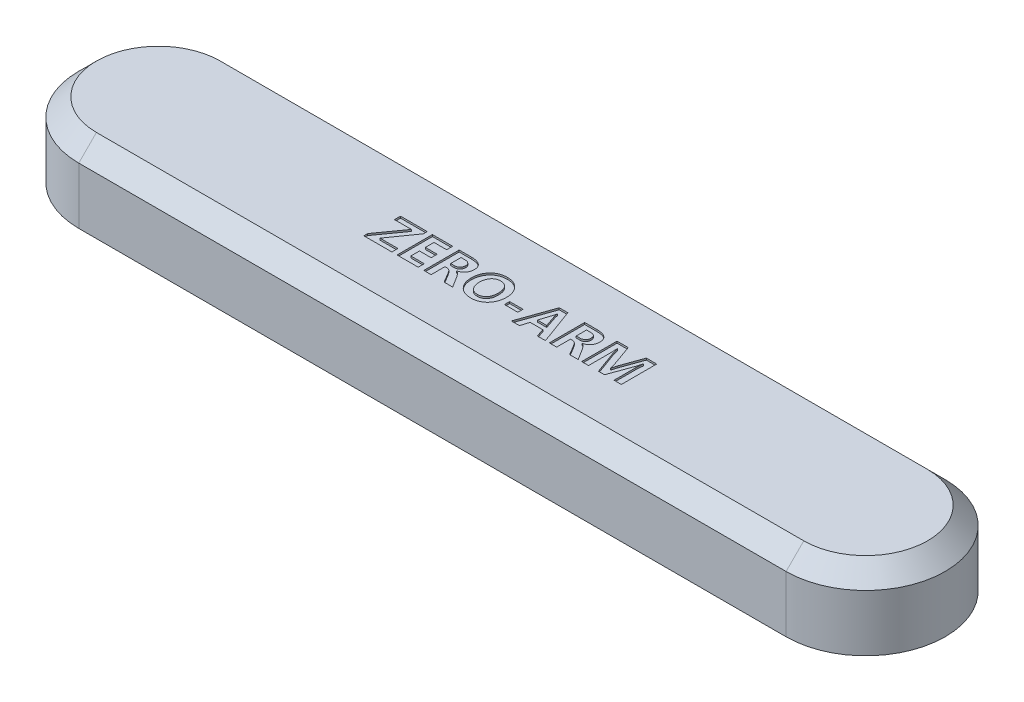
from build123d import *

# Parameters (mm, degrees)
EXTRUDE_1_DEPTH     = 21
CHAMFER_1_SIZE      = 5
SHELL_1_T           = -2.5
CUT_EXTRUDE_2_DEPTH = 1.2
SKETCH_4_R          = 5
EXTRUDE_3_DEPTH     = 17.5
SKETCH_5_R          = 1.6
CUT_EXTRUDE_3_DEPTH = 10
CUT_EXTRUDE_4_DEPTH = 2.4
SKETCH_7_W          = 3.780487805
SKETCH_7_H          = 1.463414634
CUT_EXTRUDE_5_DEPTH = 0.5


with BuildPart() as part:
    # 草图1 → 凸台-拉伸1 (new body)
    with BuildSketch(Plane(origin=(0, 0, 0), x_dir=(1, 0, 0), z_dir=(0, 1, 0))):
        with BuildLine():
            ThreePointArc((-77.5, 0), (-84.090097423, 15.909902577), (-100, 22.5))
            Line((-100, 22.5), (-100, -22.5))
            ThreePointArc((-100, -22.5), (-84.090097423, -15.909902577), (-77.5, 0))
        make_face()
        with BuildLine():
            Line((-100, -22.5), (-100, 22.5))
            ThreePointArc((-100, 22.5), (-122.5, 0), (-100, -22.5))
        make_face()
        with BuildLine():
            Line((100, 22.5), (-100, 22.5))
            ThreePointArc((-100, 22.5), (-84.090097423, 15.909902577), (-77.5, 0))
            ThreePointArc((-77.5, 0), (-84.090097423, -15.909902577), (-100, -22.5))
            Line((-100, -22.5), (100, -22.5))
            ThreePointArc((100, -22.5), (77.5, 0), (100, 22.5))
        make_face()
        with BuildLine():
            ThreePointArc((122.5, 0), (115.909902577, 15.909902577), (100, 22.5))
            Line((100, 22.5), (100, -22.5))
            ThreePointArc((100, -22.5), (115.909902577, -15.909902577), (122.5, 0))
        make_face()
        with BuildLine():
            Line((100, -22.5), (100, 22.5))
            ThreePointArc((100, 22.5), (77.5, 0), (100, -22.5))
        make_face()
    extrude(amount=EXTRUDE_1_DEPTH)

    # 倒角1
    chamfer_1_edges = [part.edges().sort_by_distance(p)[0] for p in [
        (0, 21, 22.5),
        (122.5, 21, 0),
        (0, 21, -22.5),
        (-122.5, 21, 0),
    ]]
    chamfer(chamfer_1_edges, length=CHAMFER_1_SIZE)

    # 抽壳1
    shell_1_openings = [part.faces().sort_by_distance(p)[0] for p in [
        (0, 0, 0),
    ]]
    offset(amount=SHELL_1_T, openings=shell_1_openings, kind=Kind.INTERSECTION)

    # 草图2 → 切除-拉伸2 (cut)
    with BuildSketch(Plane.XZ):
        with BuildLine():
            Line((-100, -21.2), (100, -21.2))
            ThreePointArc((100, -21.2), (121.2, 0), (100, 21.2))
            Line((100, 21.2), (-100, 21.2))
            ThreePointArc((-100, 21.2), (-121.2, 0), (-100, -21.2))
        make_face()
        with BuildLine():
            Line((-100, -20), (100, -20))
            ThreePointArc((100, -20), (120, 0), (100, 20))
            Line((100, 20), (-100, 20))
            ThreePointArc((-100, 20), (-120, 0), (-100, -20))
        make_face(mode=Mode.SUBTRACT)
    extrude(amount=-CUT_EXTRUDE_2_DEPTH, mode=Mode.SUBTRACT)

    # 草图4 → 凸台-拉伸3 (add)
    with BuildSketch(Plane.XZ.offset(-18.5)):
        with Locations(Location((-15, 0, 0), (0, 0, 90))):
            Circle(SKETCH_4_R)
    extrude_3 = extrude(amount=EXTRUDE_3_DEPTH)

    # 草图5 → 切除-拉伸3 (cut)
    with BuildSketch(Plane.XZ.offset(-1)):
        with Locations(Location((-15, 0, 0), (0, 0, 270))):
            Circle(SKETCH_5_R)
    cut_extrude_3 = extrude(amount=-CUT_EXTRUDE_3_DEPTH, mode=Mode.SUBTRACT)

    # 草图6 → 切除-拉伸4 (cut)
    with BuildSketch(Plane.XZ.offset(-1)):
        Polygon((-13.41228676, -2.75), (-11.824573519, 0), (-13.41228676, 2.75), (-16.58771324, 2.75), (-18.175426481, 0), (-16.58771324, -2.75), align=None)
    cut_extrude_4 = extrude(amount=-CUT_EXTRUDE_4_DEPTH, mode=Mode.SUBTRACT)

    # 镜向1: 凸台-拉伸3, 切除-拉伸3, 切除-拉伸4 across plane
    add(extrude_3.mirror(Plane(origin=(0, 0, 0), x_dir=(0, 0, 1), z_dir=(1, 0, 0))))
    add(cut_extrude_3.mirror(Plane(origin=(0, 0, 0), x_dir=(0, 0, 1), z_dir=(1, 0, 0))), mode=Mode.SUBTRACT)
    add(cut_extrude_4.mirror(Plane(origin=(0, 0, 0), x_dir=(0, 0, 1), z_dir=(1, 0, 0))), mode=Mode.SUBTRACT)

    # 草图7 → 切除-拉伸5 (cut)
    # profile 1 of 8: a face of its own
    with BuildSketch(Plane(origin=(0, 21, 0), x_dir=(1, 0, 0), z_dir=(0, 1, 0))):
        with BuildLine():
            Line((33.841463415, -5), (33.841463415, 1.061356707))
            add(Edge.make_bspline(
                [(33.841463415, 1.061356707), (33.84152232, 1.133778964), (33.841643281, 1.282498386), (33.853112321, 1.512383794), (33.86552206, 1.75574995), (33.884814363, 2.01303563), (33.910440556, 2.283491234), (33.937690867, 2.567715397), (33.975295445, 2.864692245), (34.001478381, 3.067207947), (34.014862805, 3.170731707)],
                knots=[0, 0, 0, 0, 0.820532149, 1.684966374, 2.607606779, 3.581914253, 4.608215301, 5.686044516, 6.81713186, 8, 8, 8, 8], degree=3))
            Line((34.014862805, 3.170731707), (33.963414634, 3.170731707))
            add(Edge.make_bspline(
                [(33.963414634, 3.170731707), (33.947784071, 3.093824023), (33.917910453, 2.946835674), (33.871179731, 2.736946179), (33.830302888, 2.546651387), (33.789921776, 2.376494295), (33.75227913, 2.225805247), (33.715712976, 2.095229622), (33.684547566, 1.984086667), (33.661368239, 1.918098365), (33.650914634, 1.888338415)],
                knots=[0, 0, 0, 0, 1.426064356, 2.725538406, 3.907327566, 4.962762773, 5.903337351, 6.72936823, 7.426959974, 8, 8, 8, 8], degree=3))
            Line((33.650914634, 1.888338415), (31.158536585, -5))
            Line((31.158536585, -5), (29.451219512, -5))
            Line((29.451219512, -5), (26.960746951, 1.823551829))
            add(Edge.make_bspline(
                [(26.960746951, 1.823551829), (26.952263157, 1.848251918), (26.932412136, 1.906047048), (26.904694926, 2.007385078), (26.872657868, 2.135937022), (26.834101068, 2.290532503), (26.794925524, 2.4733177), (26.7495779, 2.681727965), (26.696668035, 2.916796986), (26.663729611, 3.082995658), (26.646341463, 3.170731707)],
                knots=[0, 0, 0, 0, 0.452786508, 1.059464042, 1.820794487, 2.75042866, 3.822030313, 5.062086147, 6.449079346, 8, 8, 8, 8], degree=3))
            Line((26.646341463, 3.170731707), (26.589176829, 3.170731707))
            add(Edge.make_bspline(
                [(26.589176829, 3.170731707), (26.606326066, 2.75094685), (26.640641054, 1.910972851), (26.644440717, 1.070306717), (26.646341463, 0.649771341)],
                knots=[0, 0, 0, 0, 0.999518694, 2, 2, 2, 2], degree=3))
            Line((26.646341463, 0.649771341), (26.646341463, -5))
            Line((26.646341463, -5), (24.695121951, -5))
            Line((24.695121951, -5), (24.695121951, 5))
            Line((24.695121951, 5), (27.865853659, 5))
            Line((27.865853659, 5), (30.001905488, -1.044207317))
            add(Edge.make_bspline(
                [(30.001905488, -1.044207317), (30.044244035, -1.167087774), (30.126860295, -1.406867466), (30.230472788, -1.764546405), (30.311442003, -2.111250573), (30.349265281, -2.340345695), (30.367759146, -2.452362805)],
                knots=[0, 0, 0, 0, 1.070175583, 2.088260221, 3.065246074, 4, 4, 4, 4], degree=3))
            Line((30.367759146, -2.452362805), (30.411585366, -2.452362805))
            add(Edge.make_bspline(
                [(30.411585366, -2.452362805), (30.444575956, -2.320069904), (30.508517424, -2.063663387), (30.612188826, -1.694948076), (30.713260036, -1.352114621), (30.78868984, -1.135406264), (30.82507622, -1.030868902)],
                knots=[0, 0, 0, 0, 1.1046679, 2.14103741, 3.103260037, 4, 4, 4, 4], degree=3))
            Line((30.82507622, -1.030868902), (32.987804878, 5))
            Line((32.987804878, 5), (35.914634146, 5))
            Line((35.914634146, 5), (35.914634146, -5))
            Line((35.914634146, -5), (33.841463415, -5))
        make_face()
    # profile 2 of 8: a face of its own
    with BuildSketch(Plane(origin=(0, 21, 0), x_dir=(1, 0, 0), z_dir=(0, 1, 0))):
        with BuildLine():
            Line((23.719512195, -5), (21.290015244, -5))
            Line((21.290015244, -5), (19.737042683, -2.37804878))
            add(Edge.make_bspline(
                [(19.737042683, -2.37804878), (19.697214303, -2.313147359), (19.621077115, -2.189079751), (19.508541387, -2.012316653), (19.400469484, -1.854728719), (19.297321705, -1.715033671), (19.200128655, -1.592972956), (19.109608107, -1.487067553), (19.022311196, -1.401644555), (18.916023531, -1.312725889), (18.783758664, -1.22603169), (18.618101361, -1.153239455), (18.447648594, -1.106566857), (18.331718612, -1.100567269), (18.273628049, -1.097560976)],
                knots=[0, 0, 0, 0, 1.344687602, 2.570547293, 3.699885006, 4.718342757, 5.636226837, 6.4550131, 7.176785554, 7.789997554, 8.90063289, 9.955199024, 10.975384649, 12, 12, 12, 12], degree=3))
            Line((18.273628049, -1.097560976), (17.62195122, -1.097560976))
            Line((17.62195122, -1.097560976), (17.62195122, -5))
            Line((17.62195122, -5), (15.548780488, -5))
            Line((15.548780488, -5), (15.548780488, 5))
            Line((15.548780488, 5), (18.991996951, 5))
            add(Edge.make_bspline(
                [(18.991996951, 5), (19.133688638, 4.997599585), (19.40788366, 4.992954417), (19.806379939, 4.963111029), (20.17696591, 4.910572781), (20.520923961, 4.83614774), (20.837492196, 4.741954091), (21.127023154, 4.626152811), (21.388633842, 4.487756679), (21.624246274, 4.330121526), (21.83286269, 4.149961897), (22.010305726, 3.945932323), (22.163218948, 3.722739544), (22.286853211, 3.477838821), (22.382789619, 3.21152998), (22.450219302, 2.92446668), (22.493483114, 2.616276079), (22.497786357, 2.403607024), (22.5, 2.294207317)],
                knots=[0, 0, 0, 0, 1.344792196, 2.602377979, 3.789948482, 4.894324818, 5.93942703, 6.921166634, 7.848816369, 8.743320004, 9.60643787, 10.456510383, 11.302554906, 12.16796436, 13.052787244, 13.982706318, 14.96227809, 16, 16, 16, 16], degree=3))
            add(Edge.make_bspline(
                [(22.5, 2.294207317), (22.49805954, 2.210933862), (22.494242565, 2.047131067), (22.467331146, 1.805502409), (22.421503833, 1.573015739), (22.358541107, 1.349308277), (22.278738388, 1.134588575), (22.17864023, 0.92946216), (22.060357292, 0.733301397), (21.925032795, 0.546680252), (21.77449854, 0.371553855), (21.609988236, 0.208416662), (21.4310822, 0.06034869), (21.238253937, -0.074065872), (21.033562131, -0.195929417), (20.813714798, -0.302520323), (20.582174684, -0.399146389), (20.41967857, -0.449122103), (20.337271341, -0.474466463)],
                knots=[0, 0, 0, 0, 1.054005705, 2.073278704, 3.072957091, 4.050336958, 5.012048933, 5.968537561, 6.935110338, 7.908082122, 8.883044982, 9.855219194, 10.837283597, 11.818689559, 12.82802068, 13.849194482, 14.909254402, 16, 16, 16, 16], degree=3))
            Line((20.337271341, -0.474466463), (20.337271341, -0.501143293))
            add(Edge.make_bspline(
                [(20.337271341, -0.501143293), (20.395941004, -0.524149982), (20.519249457, -0.572504091), (20.696144138, -0.686032125), (20.879397295, -0.827181335), (21.066548715, -1.002920247), (21.258143735, -1.211001616), (21.454695814, -1.452191381), (21.654151855, -1.727370472), (21.784314876, -1.92464988), (21.852134146, -2.027439024)],
                knots=[0, 0, 0, 0, 0.69086025, 1.452009525, 2.2978205, 3.231026083, 4.267962337, 5.403581846, 6.647179632, 8, 8, 8, 8], degree=3))
            Line((21.852134146, -2.027439024), (23.719512195, -5))
        make_face()
        with BuildLine():
            Line((17.658155488, 3.414634146), (17.658155488, 0.487804878))
            Line((17.658155488, 0.487804878), (18.681402439, 0.487804878))
            add(Edge.make_bspline(
                [(18.681402439, 0.487804878), (18.741169585, 0.48934115), (18.857903796, 0.492341719), (19.028171092, 0.513613079), (19.189434334, 0.548101429), (19.342605393, 0.594909769), (19.485929259, 0.658549446), (19.620239969, 0.734865042), (19.744909713, 0.825600012), (19.860786305, 0.927935487), (19.965413267, 1.041294511), (20.054390295, 1.164799839), (20.134199188, 1.292136901), (20.196807416, 1.428044482), (20.244750808, 1.570636579), (20.27885505, 1.720002496), (20.300225552, 1.876294199), (20.303312748, 1.982909397), (20.304878049, 2.036966463)],
                knots=[0, 0, 0, 0, 1.139255335, 2.225136757, 3.26536478, 4.280265435, 5.272446734, 6.248687742, 7.219959804, 8.206435245, 9.192018485, 10.153504372, 11.104641096, 12.052689706, 12.998493128, 13.967800733, 14.969614728, 16, 16, 16, 16], degree=3))
            add(Edge.make_bspline(
                [(20.304878049, 2.036966463), (20.304107427, 2.092937844), (20.302622514, 2.200789328), (20.281948658, 2.357376447), (20.253495637, 2.503463651), (20.208295437, 2.638373039), (20.153408189, 2.763547164), (20.085137541, 2.877678603), (20.003607829, 2.980690096), (19.90934136, 3.071787431), (19.804785994, 3.155372091), (19.684702435, 3.222894898), (19.554189564, 3.282651939), (19.41129702, 3.331895281), (19.255684708, 3.370007901), (19.088023489, 3.396144998), (18.907794195, 3.411132554), (18.783692405, 3.413440549), (18.719512195, 3.414634146)],
                knots=[0, 0, 0, 0, 1.115541977, 2.149542461, 3.145912998, 4.079405741, 4.981150481, 5.867636171, 6.724381264, 7.5934034, 8.477895152, 9.386201992, 10.333011507, 11.338682132, 12.395710985, 13.52462607, 14.719841052, 16, 16, 16, 16], degree=3))
            Line((18.719512195, 3.414634146), (17.658155488, 3.414634146))
        make_face(mode=Mode.SUBTRACT)
    # profile 3 of 8: a face of its own
    with BuildSketch(Plane(origin=(0, 21, 0), x_dir=(1, 0, 0), z_dir=(0, 1, 0))):
        Polygon((14.451219512, -5), (12.158917683, -5), (11.421493902, -2.682926829), (7.822027439, -2.682926829), (7.096036585, -5), (4.817073171, -5), (8.353658537, 5), (10.792682927, 5), align=None)
        with BuildLine():
            Line((10.918445122, -1.097560976), (9.727515244, 2.410442073))
            add(Edge.make_bspline(
                [(9.727515244, 2.410442073), (9.710332631, 2.470608831), (9.673886471, 2.598228957), (9.630143261, 2.805525593), (9.596882028, 3.039874975), (9.581339514, 3.205588019), (9.573170732, 3.292682927)],
                knots=[0, 0, 0, 0, 0.836572256, 1.774459205, 2.830307706, 4, 4, 4, 4], degree=3))
            add(Edge.make_bspline(
                [(9.573170732, 3.292682927), (9.557008697, 3.146403329), (9.524961479, 2.856349873), (9.443808347, 2.576055415), (9.403582317, 2.437118902)],
                knots=[0, 0, 0, 0, 1.008638885, 2, 2, 2, 2], degree=3))
            Line((9.403582317, 2.437118902), (8.285060976, -1.097560976))
            Line((8.285060976, -1.097560976), (10.918445122, -1.097560976))
        make_face(mode=Mode.SUBTRACT)
    # profile 4 of 8: a face of its own
    with BuildSketch(Plane(origin=(0, 21, 0), x_dir=(1, 0, 0), z_dir=(0, 1, 0))):
        with Locations((1.707317074, -1.219512195)):
            Rectangle(SKETCH_7_W, SKETCH_7_H)
    # profile 5 of 8: a face of its own
    with BuildSketch(Plane(origin=(0, 21, 0), x_dir=(1, 0, 0), z_dir=(0, 1, 0))):
        with BuildLine():
            add(Edge.make_bspline(
                [(-11.402439024, -0.127667683), (-11.39878673, 0.061814138), (-11.391631256, 0.433041649), (-11.324578967, 0.976034675), (-11.219522706, 1.493063365), (-11.068409775, 1.982386617), (-10.875664756, 2.445125951), (-10.637760929, 2.879390033), (-10.3583689, 3.288002832), (-10.036954743, 3.665187503), (-9.682183118, 4.008421608), (-9.29585205, 4.307410381), (-8.880367822, 4.558595743), (-8.438458806, 4.765245066), (-7.968794079, 4.925719877), (-7.472042096, 5.039497786), (-6.947507935, 5.109609018), (-6.588129924, 5.117775098), (-6.404344512, 5.12195122)],
                knots=[0, 0, 0, 0, 1.114768385, 2.184023191, 3.214842008, 4.216375225, 5.193220596, 6.16016609, 7.125520499, 8.10150713, 9.071799814, 10.025905719, 10.970272928, 11.923536258, 12.891752738, 13.885610077, 14.918703956, 16, 16, 16, 16], degree=3))
            add(Edge.make_bspline(
                [(-6.404344512, 5.12195122), (-6.230119813, 5.117379621), (-5.888694604, 5.108420736), (-5.389320251, 5.043499514), (-4.916337089, 4.932853645), (-4.468561878, 4.778439305), (-4.048267424, 4.576863579), (-3.652128112, 4.334078703), (-3.28482281, 4.04399496), (-2.947266171, 3.712433641), (-2.641228117, 3.348686487), (-2.375150539, 2.955510209), (-2.148799881, 2.537615937), (-1.963634771, 2.093997687), (-1.820348925, 1.624799963), (-1.720677439, 1.13081746), (-1.658038386, 0.611999646), (-1.650297442, 0.257423987), (-1.646341463, 0.076219512)],
                knots=[0, 0, 0, 0, 1.072352965, 2.101472042, 3.093497841, 4.057995957, 5.011133745, 5.957349481, 6.91241005, 7.885665393, 8.865378779, 9.833799821, 10.803025627, 11.786228153, 12.788045293, 13.817877169, 14.884834838, 16, 16, 16, 16], degree=3))
            add(Edge.make_bspline(
                [(-1.646341463, 0.076219512), (-1.64991701, -0.112639747), (-1.656909763, -0.481994809), (-1.7247599, -1.021556354), (-1.826971505, -1.534389264), (-1.97691481, -2.020005313), (-2.169216396, -2.478547788), (-2.405210295, -2.909950675), (-2.682405129, -3.313889066), (-3.000277672, -3.686351347), (-3.351763326, -4.023165742), (-3.732357243, -4.318761648), (-4.140385281, -4.567527994), (-4.5749549, -4.771030507), (-5.035558275, -4.929265444), (-5.522774181, -5.041355834), (-6.035947566, -5.109040274), (-6.386986217, -5.117585812), (-6.566310976, -5.12195122)],
                knots=[0, 0, 0, 0, 1.125525784, 2.201208718, 3.237291209, 4.239916505, 5.226012927, 6.197109501, 7.166668921, 8.141825765, 9.111444352, 10.064375446, 11.00938735, 11.954725487, 12.920015397, 13.907536101, 14.931084707, 16, 16, 16, 16], degree=3))
            add(Edge.make_bspline(
                [(-6.566310976, -5.12195122), (-6.741217462, -5.118440561), (-7.084738049, -5.111545542), (-7.586560414, -5.042156114), (-8.063840981, -4.935317338), (-8.51515245, -4.781286219), (-8.941842802, -4.585222057), (-9.34273859, -4.343017486), (-9.718130752, -4.057264383), (-10.065019677, -3.730510341), (-10.378651043, -3.369905229), (-10.65221303, -2.980546317), (-10.887206467, -2.567481768), (-11.074952418, -2.127017195), (-11.223036858, -1.662636277), (-11.326545917, -1.173049545), (-11.391067891, -0.658484724), (-11.398597842, -0.30697829), (-11.402439024, -0.127667683)],
                knots=[0, 0, 0, 0, 1.074367157, 2.110083177, 3.10723923, 4.076300727, 5.035189706, 5.987852663, 6.948956014, 7.929336404, 8.911673334, 9.88099426, 10.849387208, 11.826872217, 12.818227126, 13.84036962, 14.89832846, 16, 16, 16, 16], degree=3))
        make_face()
        with BuildLine():
            add(Edge.make_bspline(
                [(-9.207317073, -0.013338415), (-9.204972934, -0.130905921), (-9.200376886, -0.361415171), (-9.168748483, -0.699261852), (-9.111048494, -1.020100129), (-9.03266659, -1.324521887), (-8.934939316, -1.613847817), (-8.809803774, -1.884747151), (-8.664518556, -2.140297887), (-8.497666376, -2.377263176), (-8.312616041, -2.593290374), (-8.10620859, -2.779594519), (-7.884610932, -2.938469788), (-7.64665493, -3.070110786), (-7.390281654, -3.168411034), (-7.118545802, -3.241938647), (-6.829256639, -3.283269223), (-6.631222125, -3.289501009), (-6.530106707, -3.292682927)],
                knots=[0, 0, 0, 0, 1.184931797, 2.323241753, 3.415735217, 4.466896578, 5.489261642, 6.489009157, 7.469635635, 8.448254088, 9.405790831, 10.330339266, 11.243447342, 12.148780307, 13.062964896, 14.003988727, 14.980846772, 16, 16, 16, 16], degree=3))
            add(Edge.make_bspline(
                [(-6.530106707, -3.292682927), (-6.427051454, -3.290440285), (-6.225756867, -3.286059803), (-5.93279765, -3.242586114), (-5.657250021, -3.174946437), (-5.398652814, -3.078870884), (-5.158162627, -2.954740078), (-4.934545245, -2.803481778), (-4.731928343, -2.621402255), (-4.545208345, -2.416456549), (-4.379400302, -2.186434329), (-4.234862782, -1.936714362), (-4.11202961, -1.668172257), (-4.013647167, -1.380624029), (-3.935097886, -1.074925116), (-3.880740188, -0.750460673), (-3.848029015, -0.407178731), (-3.84369216, -0.172203738), (-3.841463415, -0.051448171)],
                knots=[0, 0, 0, 0, 1.038721561, 2.028902171, 2.979739093, 3.895937291, 4.804150696, 5.703190911, 6.610748933, 7.544954394, 8.494430894, 9.464599871, 10.450689967, 11.467673243, 12.525730618, 13.630462428, 14.782275302, 16, 16, 16, 16], degree=3))
            add(Edge.make_bspline(
                [(-3.841463415, -0.051448171), (-3.843681723, 0.074386246), (-3.848002774, 0.319499603), (-3.88082202, 0.676618674), (-3.933820419, 1.013469312), (-4.007225978, 1.330552564), (-4.103968605, 1.627504218), (-4.225554712, 1.902574323), (-4.363495307, 2.160149494), (-4.526387005, 2.394299833), (-4.706208205, 2.606552169), (-4.90577368, 2.790900224), (-5.122877524, 2.947408548), (-5.359382581, 3.072961483), (-5.612266109, 3.173101408), (-5.882960264, 3.242998967), (-6.171120719, 3.286049426), (-6.369253715, 3.290431706), (-6.471036585, 3.292682927)],
                knots=[0, 0, 0, 0, 1.256364881, 2.447278127, 3.577572422, 4.659071335, 5.693985313, 6.690867229, 7.65867568, 8.606938913, 9.533575709, 10.431238956, 11.313033112, 12.198355596, 13.098167223, 14.022717975, 14.984250756, 16, 16, 16, 16], degree=3))
            add(Edge.make_bspline(
                [(-6.471036585, 3.292682927), (-6.574703586, 3.289580751), (-6.776560262, 3.283540304), (-7.071367485, 3.24152036), (-7.348738522, 3.169009709), (-7.609817761, 3.067684405), (-7.853754615, 2.937344753), (-8.080128617, 2.777172381), (-8.290939017, 2.5902755), (-8.480447067, 2.373582521), (-8.651487598, 2.136232936), (-8.800639755, 1.879597159), (-8.926702559, 1.605820831), (-9.029624292, 1.31491326), (-9.109566948, 1.006946627), (-9.166114101, 0.681953199), (-9.201134008, 0.339946249), (-9.205225686, 0.106158128), (-9.207317073, -0.013338415)],
                knots=[0, 0, 0, 0, 1.030008459, 2.005595648, 2.951664227, 3.872901532, 4.782126158, 5.692664187, 6.622487942, 7.574851405, 8.547002697, 9.525586399, 10.519618393, 11.537704223, 12.587858271, 13.677387483, 14.81283889, 16, 16, 16, 16], degree=3))
        make_face(mode=Mode.SUBTRACT)
    # profile 6 of 8: a face of its own
    with BuildSketch(Plane(origin=(0, 21, 0), x_dir=(1, 0, 0), z_dir=(0, 1, 0))):
        with BuildLine():
            Line((-11.768292683, -5), (-14.197789634, -5))
            Line((-14.197789634, -5), (-15.750762195, -2.37804878))
            add(Edge.make_bspline(
                [(-15.750762195, -2.37804878), (-15.790590575, -2.313147359), (-15.866727763, -2.189079751), (-15.979263491, -2.012316653), (-16.087335394, -1.854728719), (-16.190483173, -1.715033671), (-16.287676223, -1.592972956), (-16.378196771, -1.487067553), (-16.465493682, -1.401644555), (-16.571781347, -1.312725889), (-16.704046214, -1.22603169), (-16.869703517, -1.153239455), (-17.040156284, -1.106566857), (-17.156086266, -1.100567269), (-17.214176829, -1.097560976)],
                knots=[0, 0, 0, 0, 1.344687602, 2.570547293, 3.699885006, 4.718342757, 5.636226837, 6.4550131, 7.176785554, 7.789997554, 8.90063289, 9.955199024, 10.975384649, 12, 12, 12, 12], degree=3))
            Line((-17.214176829, -1.097560976), (-17.865853659, -1.097560976))
            Line((-17.865853659, -1.097560976), (-17.865853659, -5))
            Line((-17.865853659, -5), (-19.93902439, -5))
            Line((-19.93902439, -5), (-19.93902439, 5))
            Line((-19.93902439, 5), (-16.495807927, 5))
            add(Edge.make_bspline(
                [(-16.495807927, 5), (-16.35411624, 4.997599585), (-16.079921218, 4.992954417), (-15.681424939, 4.963111029), (-15.310838968, 4.910572781), (-14.966880917, 4.83614774), (-14.650312682, 4.741954091), (-14.360781724, 4.626152811), (-14.099171036, 4.487756679), (-13.863558604, 4.330121526), (-13.654942188, 4.149961897), (-13.477499152, 3.945932323), (-13.32458593, 3.722739544), (-13.200951667, 3.477838821), (-13.105015259, 3.21152998), (-13.037585576, 2.92446668), (-12.994321764, 2.616276079), (-12.990018521, 2.403607024), (-12.987804878, 2.294207317)],
                knots=[0, 0, 0, 0, 1.344792196, 2.602377979, 3.789948482, 4.894324818, 5.93942703, 6.921166634, 7.848816369, 8.743320004, 9.60643787, 10.456510383, 11.302554906, 12.16796436, 13.052787244, 13.982706318, 14.96227809, 16, 16, 16, 16], degree=3))
            add(Edge.make_bspline(
                [(-12.987804878, 2.294207317), (-12.989745338, 2.210933862), (-12.993562313, 2.047131067), (-13.020473732, 1.805502409), (-13.066301045, 1.573015739), (-13.129263771, 1.349308277), (-13.20906649, 1.134588575), (-13.309164648, 0.92946216), (-13.427447586, 0.733301397), (-13.562772083, 0.546680252), (-13.713306338, 0.371553855), (-13.877816642, 0.208416662), (-14.056722678, 0.06034869), (-14.249550941, -0.074065872), (-14.454242748, -0.195929417), (-14.67409008, -0.302520323), (-14.905630194, -0.399146389), (-15.068126308, -0.449122103), (-15.150533537, -0.474466463)],
                knots=[0, 0, 0, 0, 1.054005705, 2.073278704, 3.072957091, 4.050336958, 5.012048933, 5.968537561, 6.935110338, 7.908082122, 8.883044982, 9.855219194, 10.837283597, 11.818689559, 12.82802068, 13.849194482, 14.909254402, 16, 16, 16, 16], degree=3))
            Line((-15.150533537, -0.474466463), (-15.150533537, -0.501143293))
            add(Edge.make_bspline(
                [(-15.150533537, -0.501143293), (-15.091863874, -0.524149982), (-14.968555422, -0.572504091), (-14.79166074, -0.686032125), (-14.608407583, -0.827181335), (-14.421256163, -1.002920247), (-14.229661143, -1.211001616), (-14.033109064, -1.452191381), (-13.833653023, -1.727370472), (-13.703490003, -1.92464988), (-13.635670732, -2.027439024)],
                knots=[0, 0, 0, 0, 0.69086025, 1.452009525, 2.2978205, 3.231026083, 4.267962337, 5.403581846, 6.647179632, 8, 8, 8, 8], degree=3))
            Line((-13.635670732, -2.027439024), (-11.768292683, -5))
        make_face()
        with BuildLine():
            Line((-17.82964939, 3.414634146), (-17.82964939, 0.487804878))
            Line((-17.82964939, 0.487804878), (-16.806402439, 0.487804878))
            add(Edge.make_bspline(
                [(-16.806402439, 0.487804878), (-16.746635293, 0.48934115), (-16.629901082, 0.492341719), (-16.459633786, 0.513613079), (-16.298370544, 0.548101429), (-16.145199485, 0.594909769), (-16.001875619, 0.658549446), (-15.867564909, 0.734865042), (-15.742895165, 0.825600012), (-15.627018573, 0.927935487), (-15.522391611, 1.041294511), (-15.433414583, 1.164799839), (-15.35360569, 1.292136901), (-15.290997462, 1.428044482), (-15.24305407, 1.570636579), (-15.208949828, 1.720002496), (-15.187579326, 1.876294199), (-15.18449213, 1.982909397), (-15.182926829, 2.036966463)],
                knots=[0, 0, 0, 0, 1.139255335, 2.225136757, 3.26536478, 4.280265435, 5.272446734, 6.248687742, 7.219959804, 8.206435245, 9.192018485, 10.153504372, 11.104641096, 12.052689706, 12.998493128, 13.967800733, 14.969614728, 16, 16, 16, 16], degree=3))
            add(Edge.make_bspline(
                [(-15.182926829, 2.036966463), (-15.183697451, 2.092937844), (-15.185182364, 2.200789328), (-15.20585622, 2.357376447), (-15.234309241, 2.503463651), (-15.279509441, 2.638373039), (-15.334396689, 2.763547164), (-15.402667337, 2.877678603), (-15.484197049, 2.980690096), (-15.578463518, 3.071787431), (-15.683018884, 3.155372091), (-15.803102443, 3.222894898), (-15.933615314, 3.282651939), (-16.076507859, 3.331895281), (-16.23212017, 3.370007901), (-16.399781389, 3.396144998), (-16.580010683, 3.411132554), (-16.704112473, 3.413440549), (-16.768292683, 3.414634146)],
                knots=[0, 0, 0, 0, 1.115541977, 2.149542461, 3.145912998, 4.079405741, 4.981150481, 5.867636171, 6.724381264, 7.5934034, 8.477895152, 9.386201992, 10.333011507, 11.338682132, 12.395710985, 13.52462607, 14.719841052, 16, 16, 16, 16], degree=3))
            Line((-16.768292683, 3.414634146), (-17.82964939, 3.414634146))
        make_face(mode=Mode.SUBTRACT)
    # profile 7 of 8: a face of its own
    with BuildSketch(Plane(origin=(0, 21, 0), x_dir=(1, 0, 0), z_dir=(0, 1, 0))):
        Polygon((-21.524390244, -5), (-27.5, -5), (-27.5, 5), (-21.768292683, 5), (-21.768292683, 3.292682927), (-25.348704268, 3.292682927), (-25.348704268, 0.853658537), (-22.012195122, 0.853658537), (-22.012195122, -0.853658537), (-25.304878049, -0.853658537), (-25.304878049, -3.292682927), (-21.524390244, -3.292682927), align=None)
    # profile 8 of 8: a face of its own
    with BuildSketch(Plane(origin=(0, 21, 0), x_dir=(1, 0, 0), z_dir=(0, 1, 0))):
        Polygon((-28.963414634, 3.902439024), (-34.030106707, -3.292682927), (-28.963414634, -3.292682927), (-28.963414634, -5), (-36.890243902, -5), (-36.890243902, -3.902439024), (-31.733993902, 3.292682927), (-36.524390244, 3.292682927), (-36.524390244, 5), (-28.963414634, 5), align=None)
    extrude(amount=-CUT_EXTRUDE_5_DEPTH, mode=Mode.SUBTRACT)


solid = part.part
